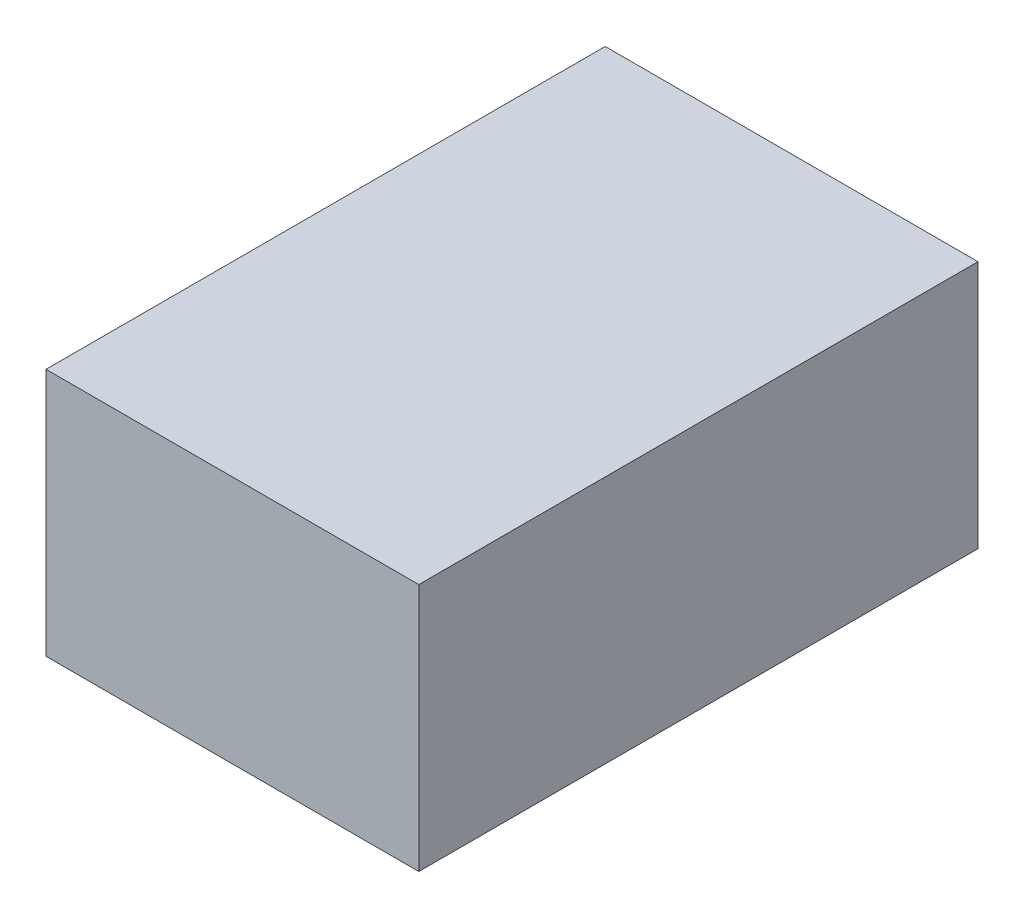
from build123d import *

# Parameters (mm, degrees)
SKETCH1_W                    = 76.2
SKETCH1_H                    = 50.8
BOSS_EXTRUDE1_DEPTH          = 114.3
CUT_EXTRUDE2_DEPTH           = 49.022
SKETCH6_R                    = 2.286
CUT_EXTRUDE3_DEPTH           = 5.08
CUT_EXTRUDE3_DRAFT           = -3
CUT_EXTRUDE3_PROFILE_2_DEPTH = 5.08
CUT_EXTRUDE3_PROFILE_2_DRAFT = -3
CUT_EXTRUDE3_PROFILE_3_DEPTH = 5.08
CUT_EXTRUDE3_PROFILE_3_DRAFT = -3
CUT_EXTRUDE3_PROFILE_4_DEPTH = 5.08
CUT_EXTRUDE3_PROFILE_4_DRAFT = -3
SKETCH10_W                   = 15.24
SKETCH10_H                   = 15.24
SKETCH10_W_2                 = 17.018
CUT_EXTRUDE4_DEPTH           = 5.08


with BuildPart() as part:
    # Sketch1 → Boss-Extrude1 (new body)
    with BuildSketch(Plane.XY):
        with Locations((38.1, 10.497687861)):
            Rectangle(SKETCH1_W, SKETCH1_H)
    extrude(amount=BOSS_EXTRUDE1_DEPTH)

    # Sketch3 → Cut-Extrude2 (cut)
    with BuildSketch(Plane.XZ.offset(14.902312139)):
        Polygon((65.532, 112.522), (10.668, 112.522), (10.668, 103.632), (1.778, 103.632), (1.778, 10.668), (10.668, 10.668), (10.668, 1.778), (65.532, 1.778), (65.532, 10.668), (74.422, 10.668), (74.422, 103.632), (65.532, 103.632), align=None)
    extrude(amount=-CUT_EXTRUDE2_DEPTH, mode=Mode.SUBTRACT)


with BuildPart() as cut_extrude3_tool:
    # Sketch6 → Cut-Extrude3 (with draft: the straight prism first)
    with BuildSketch(Plane(origin=(0, -14.902312139, 0), x_dir=(-1, 0, 0), z_dir=(0, -1, 0))):
        with Locations((-69.85, -6.35)):
            Circle(SKETCH6_R)
    extrude(amount=-CUT_EXTRUDE3_DEPTH)
    # Cut-Extrude3: the draft: its side faces are tilted about the plane it starts from
    cut_extrude3_sides = [cut_extrude3_tool.faces().sort_by_distance(p)[0] for p in [
        (72.136, -12.362312139, 6.35),
    ]]
    draft(cut_extrude3_sides, Plane(origin=(0, -14.902312139, 0), x_dir=(-1, 0, 0), z_dir=(0, -1, 0)), CUT_EXTRUDE3_DRAFT)


with BuildPart() as part_1:
    add(part.part)

    # Cut-Extrude3: cut by cut_extrude3_tool
    add(cut_extrude3_tool.part, mode=Mode.SUBTRACT)


with BuildPart() as cut_extrude3_profile_2_tool:
    # Sketch6 → Cut-Extrude3 profile 2 (with draft: the straight prism first)
    with BuildSketch(Plane(origin=(0, -14.902312139, 0), x_dir=(-1, 0, 0), z_dir=(0, -1, 0))):
        with Locations((-6.35, -6.35)):
            Circle(SKETCH6_R)
    extrude(amount=-CUT_EXTRUDE3_PROFILE_2_DEPTH)
    # Cut-Extrude3 profile 2: the draft: its side faces are tilted about the plane it starts from
    cut_extrude3_profile_2_sides = [cut_extrude3_profile_2_tool.faces().sort_by_distance(p)[0] for p in [
        (8.636, -12.362312139, 6.35),
    ]]
    draft(cut_extrude3_profile_2_sides, Plane(origin=(0, -14.902312139, 0), x_dir=(-1, 0, 0), z_dir=(0, -1, 0)), CUT_EXTRUDE3_PROFILE_2_DRAFT)


with BuildPart() as part_2:
    add(part_1.part)

    # Cut-Extrude3 profile 2: cut by cut_extrude3_profile_2_tool
    add(cut_extrude3_profile_2_tool.part, mode=Mode.SUBTRACT)


with BuildPart() as cut_extrude3_profile_3_tool:
    # Sketch6 → Cut-Extrude3 profile 3 (with draft: the straight prism first)
    with BuildSketch(Plane(origin=(0, -14.902312139, 0), x_dir=(-1, 0, 0), z_dir=(0, -1, 0))):
        with Locations((-6.35, -107.95)):
            Circle(SKETCH6_R)
    extrude(amount=-CUT_EXTRUDE3_PROFILE_3_DEPTH)
    # Cut-Extrude3 profile 3: the draft: its side faces are tilted about the plane it starts from
    cut_extrude3_profile_3_sides = [cut_extrude3_profile_3_tool.faces().sort_by_distance(p)[0] for p in [
        (8.636, -12.362312139, 107.95),
    ]]
    draft(cut_extrude3_profile_3_sides, Plane(origin=(0, -14.902312139, 0), x_dir=(-1, 0, 0), z_dir=(0, -1, 0)), CUT_EXTRUDE3_PROFILE_3_DRAFT)


with BuildPart() as part_3:
    add(part_2.part)

    # Cut-Extrude3 profile 3: cut by cut_extrude3_profile_3_tool
    add(cut_extrude3_profile_3_tool.part, mode=Mode.SUBTRACT)


with BuildPart() as cut_extrude3_profile_4_tool:
    # Sketch6 → Cut-Extrude3 profile 4 (with draft: the straight prism first)
    with BuildSketch(Plane(origin=(0, -14.902312139, 0), x_dir=(-1, 0, 0), z_dir=(0, -1, 0))):
        with Locations((-69.85, -107.95)):
            Circle(SKETCH6_R)
    extrude(amount=-CUT_EXTRUDE3_PROFILE_4_DEPTH)
    # Cut-Extrude3 profile 4: the draft: its side faces are tilted about the plane it starts from
    cut_extrude3_profile_4_sides = [cut_extrude3_profile_4_tool.faces().sort_by_distance(p)[0] for p in [
        (72.136, -12.362312139, 107.95),
    ]]
    draft(cut_extrude3_profile_4_sides, Plane(origin=(0, -14.902312139, 0), x_dir=(-1, 0, 0), z_dir=(0, -1, 0)), CUT_EXTRUDE3_PROFILE_4_DRAFT)


with BuildPart() as part_4:
    add(part_3.part)

    # Cut-Extrude3 profile 4: cut by cut_extrude3_profile_4_tool
    add(cut_extrude3_profile_4_tool.part, mode=Mode.SUBTRACT)

    # Sketch10 → Cut-Extrude4 (cut)
    with BuildSketch(Plane(origin=(0, 0, 0), x_dir=(-1, 0, 0), z_dir=(0, 0, -1))):
        with Locations((-55.88, 25.737687861)):
            Rectangle(SKETCH10_W, SKETCH10_H)
        with Locations((-19.751, 25.737687861)):
            Rectangle(SKETCH10_W_2, SKETCH10_H)
    extrude(amount=-CUT_EXTRUDE4_DEPTH, mode=Mode.SUBTRACT)


solid = part_4.part
